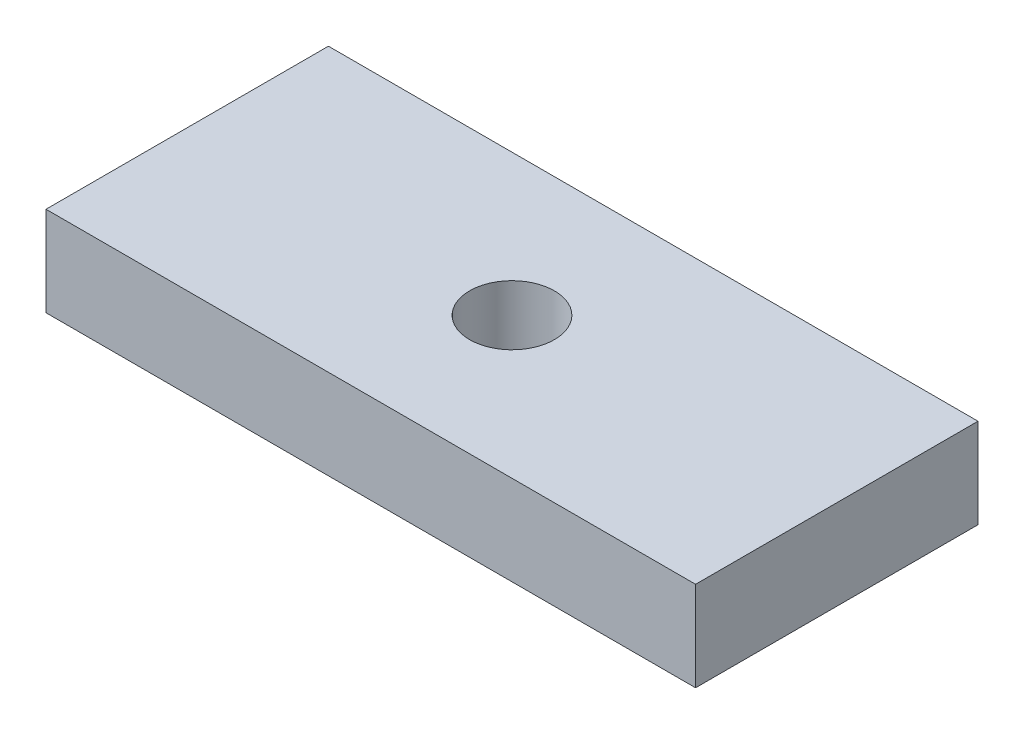
from build123d import *

# Parameters (mm, degrees)
SKETCH1_W           = 46
SKETCH1_H           = 20
SKETCH1_R           = 3
BOSS_EXTRUDE1_DEPTH = 6.35


with BuildPart() as part:
    # Sketch1 → Boss-Extrude1 (new body)
    with BuildSketch(Plane(origin=(0, 0, 0), x_dir=(1, 0, 0), z_dir=(0, 1, 0))):
        Rectangle(SKETCH1_W, SKETCH1_H)
        with Locations(Location((0, 0, 0), (0, 0, 270))):
            Circle(SKETCH1_R, mode=Mode.SUBTRACT)
    extrude(amount=BOSS_EXTRUDE1_DEPTH)


solid = part.part
